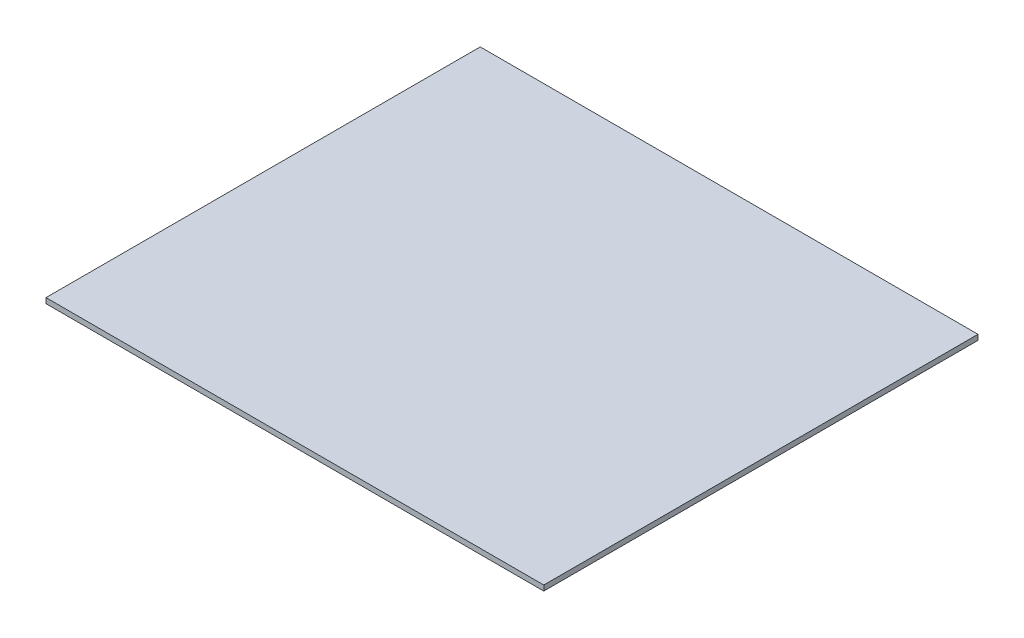
from build123d import *

# Parameters (mm, degrees)
SKETCH1_W           = 596.9
SKETCH1_H           = 520.7
BOSS_EXTRUDE1_DEPTH = 6.35


with BuildPart() as part:
    # Sketch1 → Boss-Extrude1 (new body)
    with BuildSketch(Plane(origin=(0, 0, 0), x_dir=(1, 0, 0), z_dir=(0, 1, 0))):
        with Locations((281.144050992, 249.461189802)):
            Rectangle(SKETCH1_W, SKETCH1_H)
    extrude(amount=BOSS_EXTRUDE1_DEPTH)


solid = part.part
